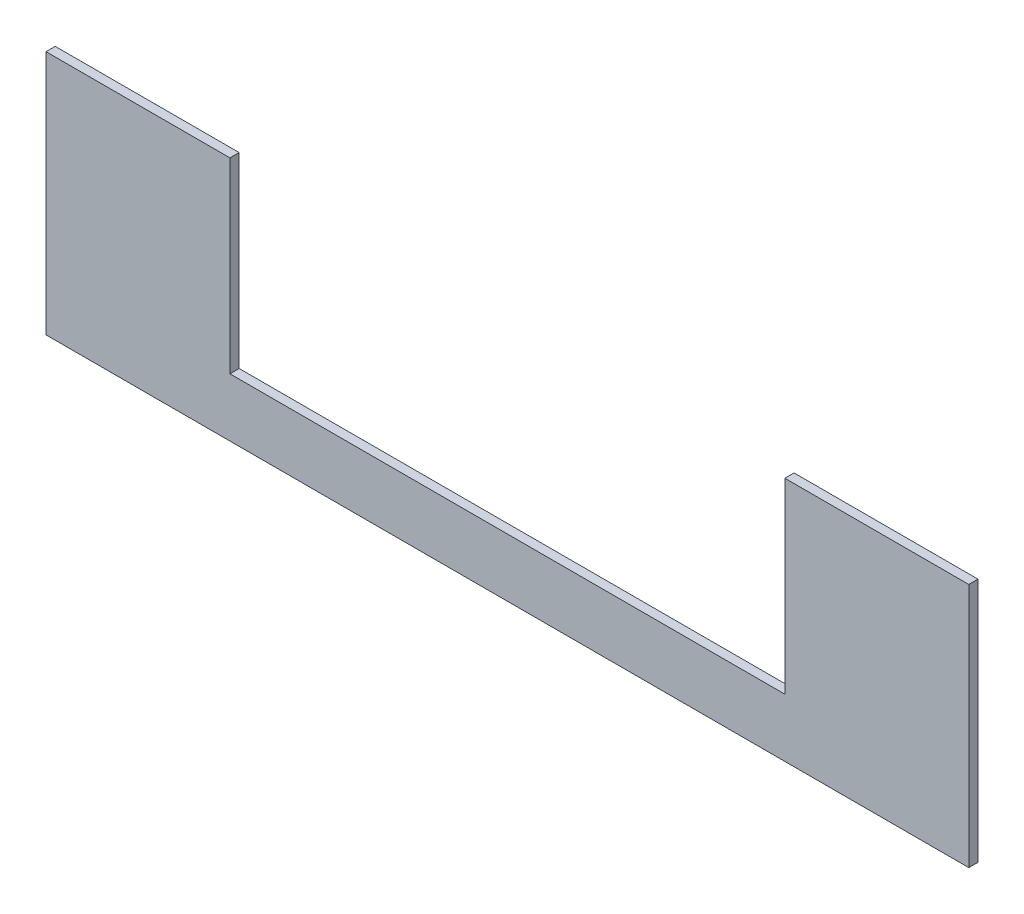
from build123d import *

# Parameters (mm, degrees)
ESQUISSE1_W             = 301
ESQUISSE1_H             = 80
BOSS_EXTRU_1_DEPTH      = 3
ESQUISSE2_W             = 181
ESQUISSE2_H             = 61
ENL_V_MAT_EXTRU_1_DEPTH = 312.464283667


with BuildPart() as part:
    # Esquisse1 → Boss.-Extru.1 (new body)
    with BuildSketch(Plane.XY):
        with Locations((-150.5, 40)):
            Rectangle(ESQUISSE1_W, ESQUISSE1_H)
    extrude(amount=BOSS_EXTRU_1_DEPTH)

    # Esquisse2 → Enlèv. mat.-Extru.1 (cut, through all)
    with BuildSketch(Plane.XY.offset(3)):
        with Locations((-150.5, 49.5)):
            Rectangle(ESQUISSE2_W, ESQUISSE2_H)
    extrude(amount=-ENL_V_MAT_EXTRU_1_DEPTH, mode=Mode.SUBTRACT)


solid = part.part
